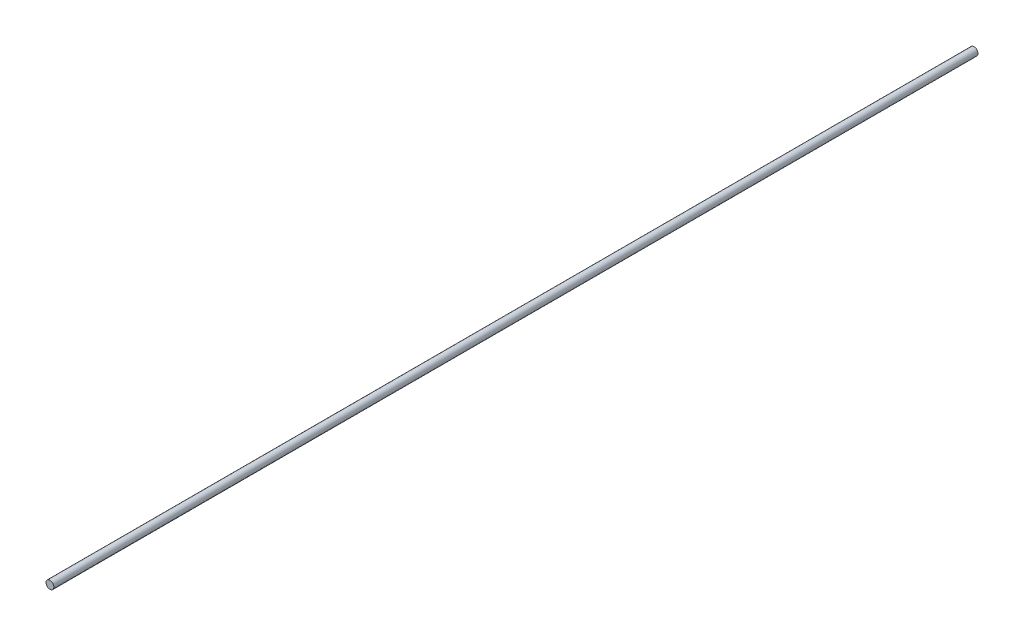
from build123d import *

# Parameters (mm, degrees)
SKETCH1_R           = 6.35
BOSS_EXTRUDE1_DEPTH = 1491.234


with BuildPart() as part:
    # Sketch1 → Boss-Extrude1 (new body)
    with BuildSketch(Plane.XY):
        Circle(SKETCH1_R)
    extrude(amount=BOSS_EXTRUDE1_DEPTH)


solid = part.part
